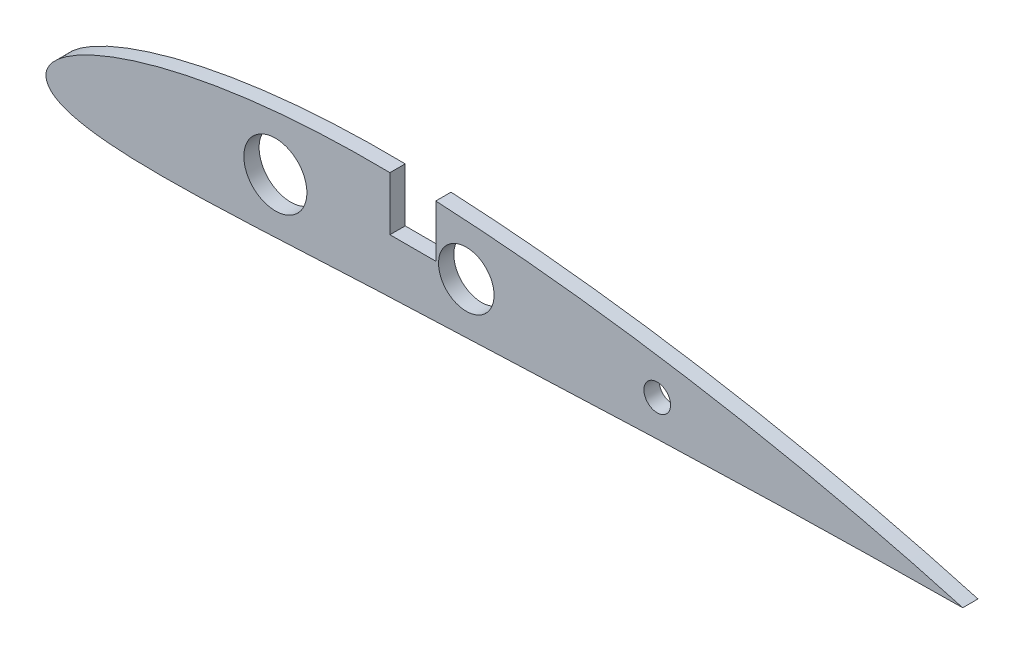
from build123d import *

# Parameters (mm, degrees)
EXTRUDE_1_DEPTH     = 4
SKETCH_2_R          = 8.258
CUT_EXTRUDE_1_DEPTH = 242.202600441
SKETCH_3_R          = 7.273
CUT_EXTRUDE_2_DEPTH = 242.202600441
SKETCH_4_R          = 3.493
CUT_EXTRUDE_3_DEPTH = 242.202600441
SKETCH_6_W          = 12
SKETCH_6_H          = 16
CUT_EXTRUDE_5_DEPTH = 241.074


with BuildPart() as part:
    # 草图1 → 凸台-拉伸1 (new body)
    with BuildSketch(Plane.XY):
        with BuildLine():
            add(Edge.make_bspline(
                [(0, 0), (-0.005288637, 0.027306965), (-0.012766006, 0.065915068), (-0.022153323, 0.120712697), (-0.030210585, 0.170851793), (-0.040453144, 0.241913365), (-0.052682719, 0.342725743), (-0.065440984, 0.485978709), (-0.074387813, 0.690065352), (-0.0686987, 0.982013321), (-0.033036091, 1.312214714), (0.030597532, 1.635567859), (0.121591356, 1.976920534), (0.250371604, 2.342321824), (0.472341281, 2.838466056), (0.773081644, 3.370456853), (1.161583787, 3.931187821), (1.559387095, 4.428056884), (2.091714531, 5.022476136), (2.777798061, 5.692302492), (3.627283356, 6.418758526), (4.764693829, 7.29468167), (6.21745515, 8.278032448), (7.997488076, 9.336645637), (9.795579221, 10.298627307), (11.608712321, 11.184679179), (13.434634677, 12.008148722), (15.271537967, 12.778295153), (17.729476359, 13.741402594), (20.82544579, 14.843263376), (24.571919444, 16.030165468), (28.339560161, 17.0985386), (32.12487346, 18.061784525), (35.925100546, 18.929826892), (39.737940185, 19.71030891), (43.561453276, 20.409312511), (47.393975172, 21.031785496), (51.234054288, 21.581857689), (55.080411196, 22.063026744), (58.93190557, 22.478304615), (62.787513331, 22.830322648), (66.646308068, 23.121396522), (70.507447303, 23.353594238), (74.370160091, 23.528775696), (78.233740528, 23.64862295), (82.097536671, 23.71465077), (85.960951375, 23.728342975), (89.823414351, 23.690681955), (93.676431779, 23.604193967), (98.773727292, 23.420984207), (105.114156567, 23.11272469), (112.702347417, 22.628659762), (120.283713822, 22.034341773), (127.857230034, 21.335464614), (135.421970656, 20.536435505), (142.977108491, 19.641124977), (150.521889929, 18.652745922), (158.055616957, 17.573950453), (165.577630234, 16.40685992), (173.087293464, 15.153093694), (180.583977279, 13.813795243), (188.067047998, 12.389661186), (195.535844753, 10.880930145), (202.989689487, 9.287480887), (210.42779734, 7.608573405), (217.849539663, 5.84383764), (225.253408528, 3.989662589), (232.640819939, 2.052702909), (237.546398163, 0.684385432), (240, 0)],
                knots=[0, 0, 0, 0, 0.000334769, 0.000473316, 0.000669154, 0.000945993, 0.001337428, 0.001891329, 0.00267667, 0.003795116, 0.005402936, 0.006666891, 0.007758358, 0.009652829, 0.011322553, 0.014295747, 0.016992284, 0.019525911, 0.021951885, 0.026593, 0.031053929, 0.035398825, 0.043866662, 0.052149912, 0.06031708, 0.068404975, 0.076435568, 0.084422966, 0.092376749, 0.108208031, 0.123966084, 0.139671769, 0.155338281, 0.170974475, 0.186586558, 0.202179035, 0.217755286, 0.23331791, 0.248868948, 0.264410046, 0.279942548, 0.295467586, 0.310986112, 0.326498966, 0.342006877, 0.357510513, 0.373010481, 0.388507334, 0.404001612, 0.419397139, 0.449898857, 0.480404337, 0.510913986, 0.541428053, 0.571946709, 0.602470142, 0.632998582, 0.663532351, 0.694071887, 0.72461776, 0.755170709, 0.785731637, 0.816301636, 0.846881995, 0.877474214, 0.90808002, 0.938701381, 0.969340535, 1, 1, 1, 1], degree=3))
            add(Edge.make_bspline(
                [(240, 0), (234.917110018, -0.057585286), (224.775588822, -0.172481024), (209.598003822, -0.415904891), (194.487002613, -0.728245316), (179.43634205, -1.119488516), (164.440499209, -1.588334416), (149.494278082, -2.127659731), (134.592329132, -2.722835319), (119.728536963, -3.349183783), (107.362573716, -3.873637958), (97.514772, -4.261389001), (87.760339877, -4.645426988), (75.622774809, -5.230840469), (63.487065009, -5.85519136), (53.755908235, -6.320131596), (46.424136767, -6.628108223), (39.053992561, -6.865167611), (32.880602935, -6.967424), (27.910517319, -6.957709617), (24.15127632, -6.890661049), (20.363099883, -6.745172216), (17.186217127, -6.535965403), (14.625579122, -6.293161259), (12.683505874, -6.062687015), (10.723085806, -5.771507493), (8.738176655, -5.399451237), (7.07063002, -4.997986268), (5.721860643, -4.593172323), (4.684001624, -4.227462917), (3.812952451, -3.858710942), (3.107354908, -3.505548627), (2.55876921, -3.193744289), (1.993245962, -2.820474949), (1.51744672, -2.442105711), (1.126053407, -2.067776646), (0.868943424, -1.77917403), (0.655201004, -1.498576542), (0.473117664, -1.22421341), (0.31383558, -0.932970965), (0.19658861, -0.665620959), (0.12645379, -0.47377542), (0.083168463, -0.336628772), (0.05569496, -0.238865361), (0.037823046, -0.169329158), (0.025977828, -0.119947575), (0.013567454, -0.065754641), (0.005620681, -0.027240622), (0, 0)],
                knots=[0, 0, 0, 0, 0.062942783, 0.125585163, 0.18795959, 0.250093756, 0.31201177, 0.373735315, 0.435284959, 0.496681733, 0.557949376, 0.588543732, 0.618716521, 0.678826646, 0.739009654, 0.769185836, 0.799459682, 0.829874332, 0.86049191, 0.875906175, 0.891414582, 0.90704545, 0.922843998, 0.930829512, 0.938892479, 0.947057741, 0.955366051, 0.963891837, 0.968280742, 0.972798276, 0.977511782, 0.979981449, 0.982565286, 0.985320539, 0.988364768, 0.990077086, 0.992021988, 0.99314336, 0.994442585, 0.996095981, 0.99724642, 0.998054303, 0.998624116, 0.999026805, 0.999311606, 0.999513077, 0.999655604, 1, 1, 1, 1], degree=3))
        make_face()
    extrude(amount=EXTRUDE_1_DEPTH)

    # 草图2 → 切除-拉伸1 (cut, through all)
    with BuildSketch(Plane.XY.offset(4)):
        with Locations((60, 8.25)):
            Circle(SKETCH_2_R)
    extrude(amount=-CUT_EXTRUDE_1_DEPTH, mode=Mode.SUBTRACT)

    # 草图3 → 切除-拉伸2 (cut, through all)
    with BuildSketch(Plane.XY.offset(4)):
        with Locations((110, 9.5093)):
            Circle(SKETCH_3_R)
    extrude(amount=-CUT_EXTRUDE_2_DEPTH, mode=Mode.SUBTRACT)

    # 草图4 → 切除-拉伸3 (cut, through all)
    with BuildSketch(Plane.XY.offset(4)):
        with Locations((160, 7.7037)):
            Circle(SKETCH_4_R)
    extrude(amount=-CUT_EXTRUDE_3_DEPTH, mode=Mode.SUBTRACT)

    # 草图6 → 切除-拉伸5 (cut, symmetric)
    with BuildSketch(Plane.XY):
        with Locations((96, 17.6)):
            Rectangle(SKETCH_6_W, SKETCH_6_H)
    extrude(amount=CUT_EXTRUDE_5_DEPTH, both=True, mode=Mode.SUBTRACT)


solid = part.part
